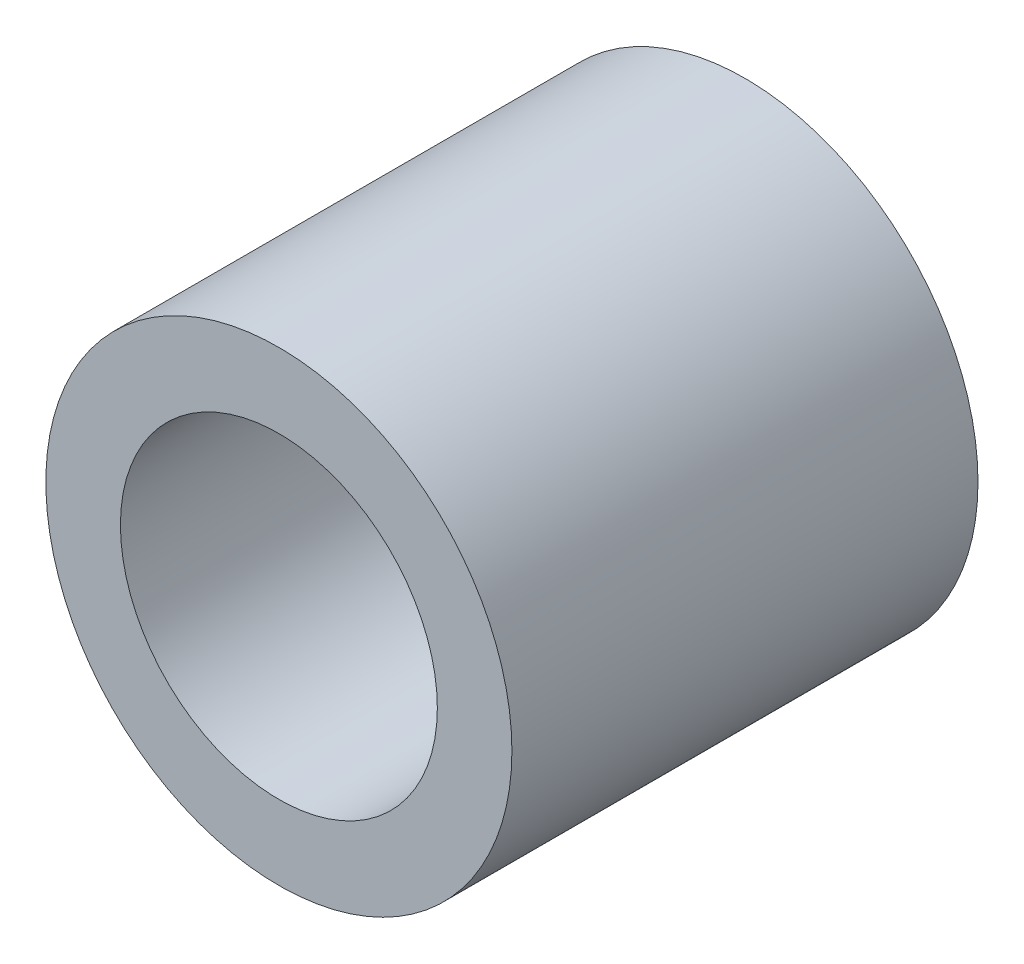
from build123d import *

# Parameters (mm, degrees)
SKETCH1_R           = 2.5
SKETCH1_R_2         = 1.7
BOSS_EXTRUDE1_DEPTH = 2.5


with BuildPart() as part:
    # Sketch1 → Boss-Extrude1 (new, symmetric)
    with BuildSketch(Plane.XY):
        Circle(SKETCH1_R)
        Circle(SKETCH1_R_2, mode=Mode.SUBTRACT)
    extrude(amount=BOSS_EXTRUDE1_DEPTH, both=True)


solid = part.part
